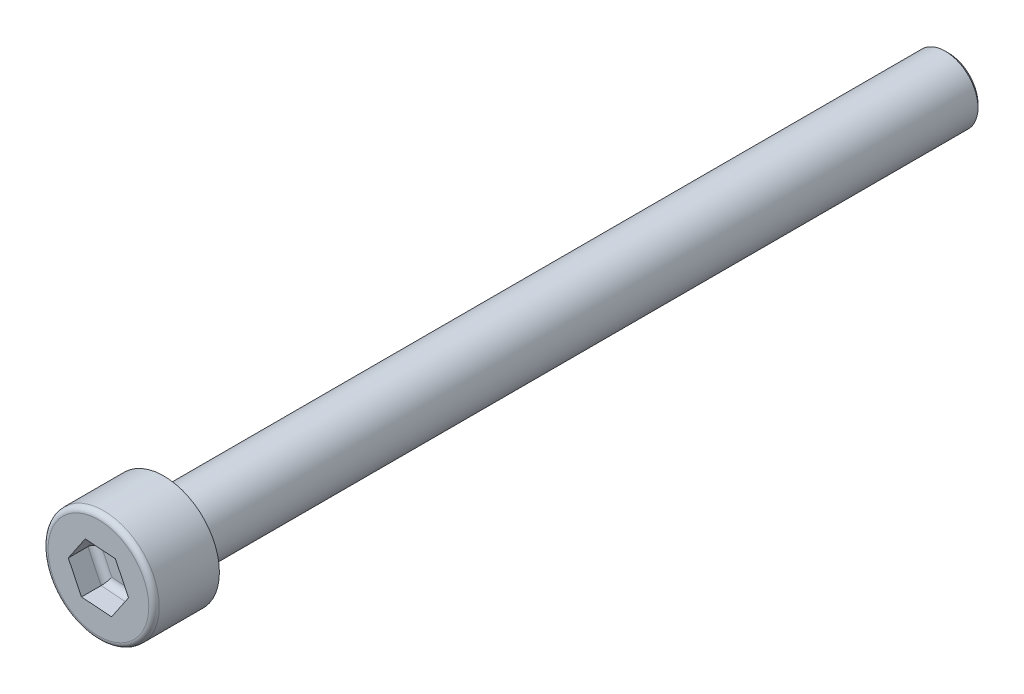
from build123d import *

# Parameters (mm, degrees)
SKETCH1_R           = 2.5
BOSS_EXTRUDE1_DEPTH = 60
SKETCH2_R           = 4.25
BOSS_EXTRUDE2_DEPTH = 5
CUT_EXTRUDE1_DEPTH  = 2
FILLET1_R           = 0.4
CHAMFER1_SIZE       = 0.25
FILLET2_R           = 0.5


with BuildPart() as part:
    # Sketch1 → Boss-Extrude1 (new body)
    with BuildSketch(Plane.XY):
        Circle(SKETCH1_R)
    extrude(amount=BOSS_EXTRUDE1_DEPTH)

    # Sketch2 → Boss-Extrude2 (add)
    with BuildSketch(Plane.XY.offset(60)):
        Circle(SKETCH2_R)
    extrude(amount=BOSS_EXTRUDE2_DEPTH)

    # Sketch3 → Cut-Extrude1 (cut)
    with BuildSketch(Plane.XY.offset(65)):
        Polygon((2.30345988, -0.165547312), (1.295098118, 1.912081117), (-1.008361763, 2.077628429), (-2.30345988, 0.165547312), (-1.295098118, -1.912081117), (1.008361763, -2.077628429), align=None)
    extrude(amount=-CUT_EXTRUDE1_DEPTH, mode=Mode.SUBTRACT)

    # Fillet1
    fillet1_edges = [part.edges().sort_by_distance(p)[0] for p in [
        (-4.25, 0, 65),
    ]]
    fillet(fillet1_edges, radius=FILLET1_R)

    # Chamfer1
    chamfer1_edges = [part.edges().sort_by_distance(p)[0] for p in [
        (-2.5, 0, 0),
    ]]
    chamfer(chamfer1_edges, length=CHAMFER1_SIZE)

    # Fillet2
    fillet2_edges = [part.edges().sort_by_distance(p)[0] for p in [
        (1.655910822, -1.12158787, 63),
        (-0.143368178, -1.994854773, 63),
        (-1.799278999, -0.873266903, 63),
        (-1.655910822, 1.12158787, 63),
        (0.143368178, 1.994854773, 63),
        (1.799278999, 0.873266903, 63),
    ]]
    fillet(fillet2_edges, radius=FILLET2_R)


solid = part.part
